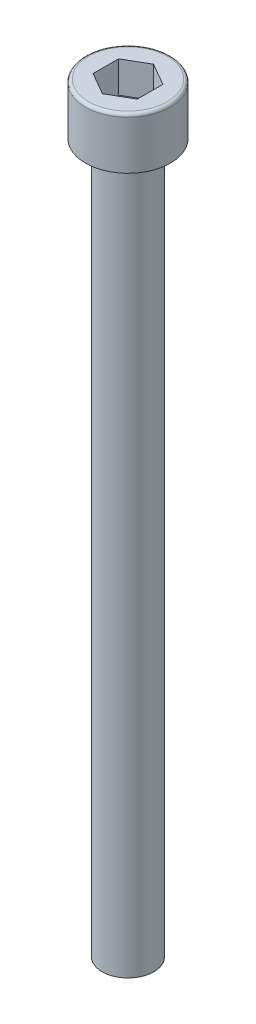
from build123d import *

# Parameters (mm, degrees)
SKETCH1_R   = 2.0828
SHAFT_DEPTH = 57.15
SKETCH2_R   = 3.429
HEAD_DEPTH  = 4.1656
FILLET1_R   = 0.254
HEX_2_DEPTH = 2.54


with BuildPart() as part:
    # Sketch1 → Shaft (new body)
    with BuildSketch(Plane(origin=(0, 0, 0), x_dir=(1, 0, 0), z_dir=(0, 1, 0))):
        with Locations(Location((0, 0, 0), (0, 0, 270))):
            Circle(SKETCH1_R)
    extrude(amount=-SHAFT_DEPTH)

    # Sketch2 → Head (add)
    with BuildSketch(Plane(origin=(0, 0, 0), x_dir=(1, 0, 0), z_dir=(0, 1, 0))):
        with Locations(Location((0, 0, 0), (0, 0, 270))):
            Circle(SKETCH2_R)
    extrude(amount=HEAD_DEPTH)

    # Fillet1
    fillet1_edges = [part.edges().sort_by_distance(p)[0] for p in [
        (0, 4.1656, -3.429),
    ]]
    fillet(fillet1_edges, radius=FILLET1_R)

    # Sketch3 → Hex 2 (cut)
    with BuildSketch(Plane(origin=(0, 4.1656, 0), x_dir=(1, 0, 0), z_dir=(0, 1, 0))):
        Polygon((0, 2.062222993), (-1.7859375, 1.031111496), (-1.7859375, -1.031111496), (0, -2.062222993), (1.7859375, -1.031111496), (1.7859375, 1.031111496), align=None)
    extrude(amount=-HEX_2_DEPTH, mode=Mode.SUBTRACT)


solid = part.part
